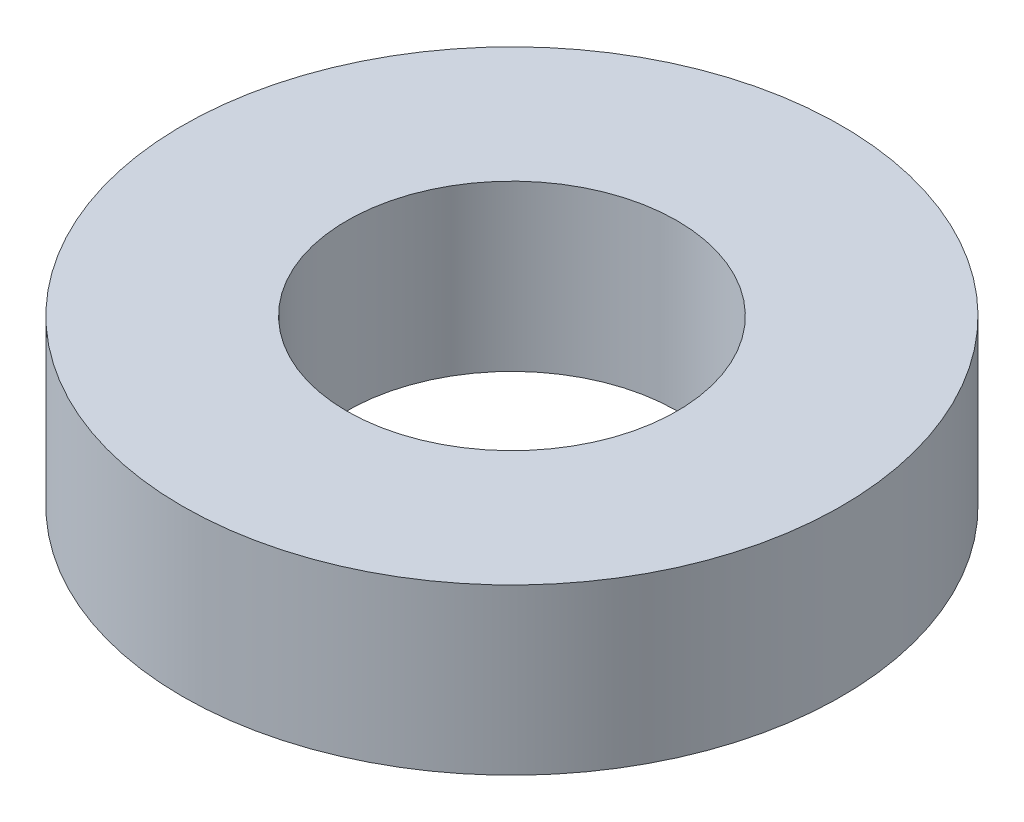
from build123d import *

# Parameters (mm, degrees)
SKETCH1_R           = 25.4
SKETCH1_R_2         = 12.720955
BOSS_EXTRUDE1_DEPTH = 12.7


with BuildPart() as part:
    # Sketch1 → Boss-Extrude1 (new body)
    with BuildSketch(Plane(origin=(0, 0, 0), x_dir=(1, 0, 0), z_dir=(0, 1, 0))):
        with Locations(Location((0, 0, 0), (0, 0, 270))):
            Circle(SKETCH1_R)
        with Locations(Location((0, 0, 0), (0, 0, 270))):
            Circle(SKETCH1_R_2, mode=Mode.SUBTRACT)
    extrude(amount=BOSS_EXTRUDE1_DEPTH)


solid = part.part
